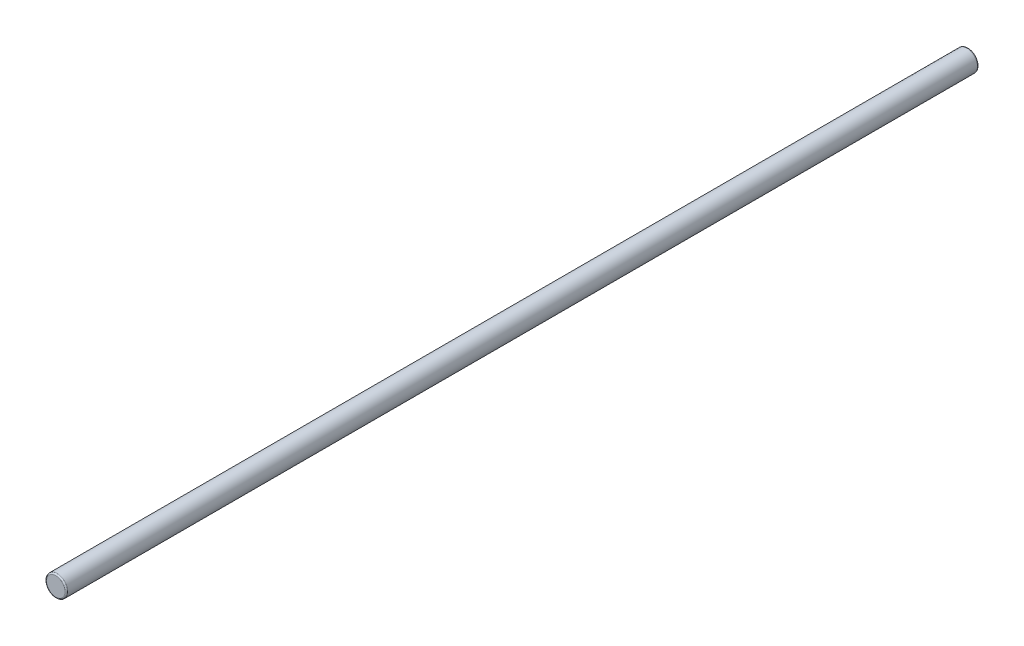
from build123d import *

# Parameters (mm, degrees)
CROQUIS1_R              = 4
SALIENTE_EXTRUIR1_DEPTH = 345
REDONDEO1_R             = 0.5


with BuildPart() as part:
    # Croquis1 → Saliente-Extruir1 (new body)
    with BuildSketch(Plane.XY):
        Circle(CROQUIS1_R)
    extrude(amount=SALIENTE_EXTRUIR1_DEPTH)

    # Redondeo1
    redondeo1_edges = [part.edges().sort_by_distance(p)[0] for p in [
        (-4, 0, 0),
        (-4, 0, 345),
    ]]
    fillet(redondeo1_edges, radius=REDONDEO1_R)


solid = part.part
